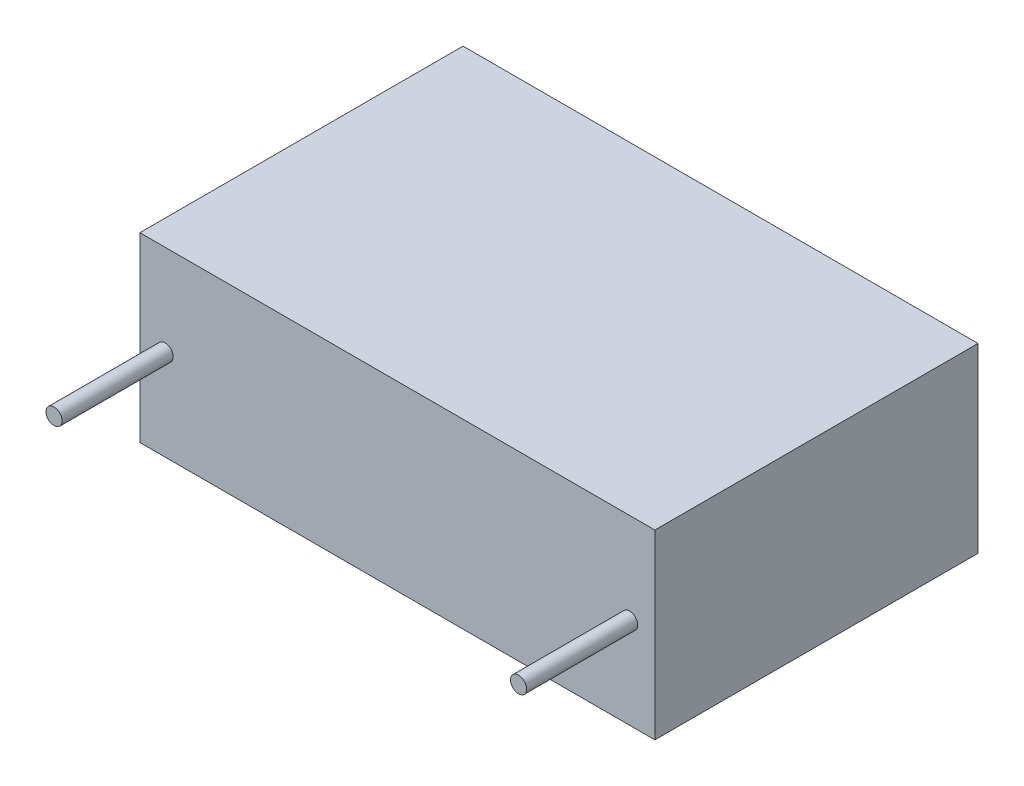
from build123d import *

# Parameters (mm, degrees)
SKETCH_1_W      = 25.5
SKETCH_1_H      = 9
EXTRUDE_1_DEPTH = 16
SKETCH_2_R      = 0.4
EXTRUDE_2_DEPTH = 5.5


with BuildPart() as part:
    # Эскиз1 → Вытянуть1 (new body)
    with BuildSketch(Plane.XY):
        with Locations((12.75, 4.5)):
            Rectangle(SKETCH_1_W, SKETCH_1_H)
    extrude(amount=EXTRUDE_1_DEPTH)

    # Эскиз2 → Вытянуть2 (add)
    with BuildSketch(Plane.XY.offset(16)):
        with Locations(Location((1.25, 4.5, 0), (0, 0, 180))):
            Circle(SKETCH_2_R)
        with Locations(Location((24.25, 4.5, 0), (0, 0, 180))):
            Circle(SKETCH_2_R)
    extrude(amount=EXTRUDE_2_DEPTH)


solid = part.part
